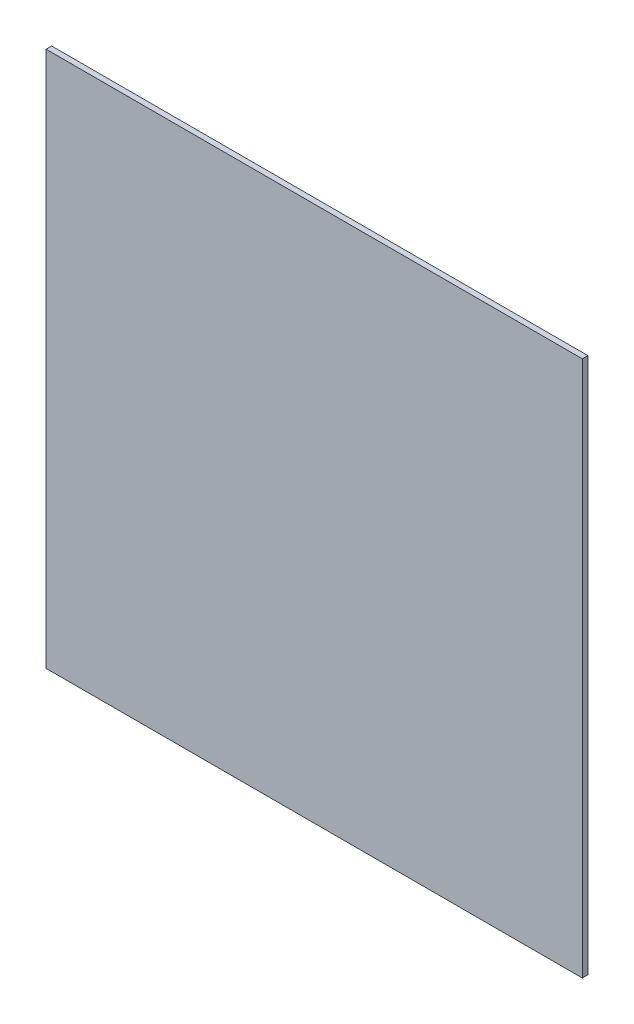
from build123d import *

# Parameters (mm, degrees)
SKETCH1_W           = 152.4
SKETCH1_H           = 152.4
BOSS_EXTRUDE1_DEPTH = 1.5875


with BuildPart() as part:
    # Sketch1 → Boss-Extrude1 (new body)
    with BuildSketch(Plane.XY):
        with Locations((10.054050494, -28.826606557)):
            Rectangle(SKETCH1_W, SKETCH1_H)
    extrude(amount=BOSS_EXTRUDE1_DEPTH)


solid = part.part
